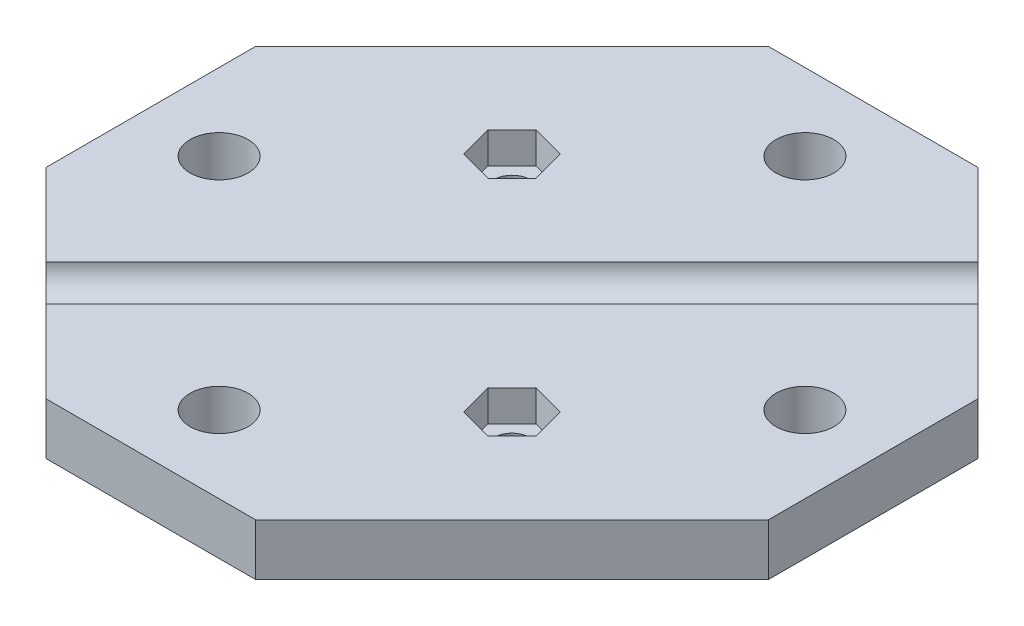
from build123d import *

# Parameters (mm, degrees)
SKETCH1_R           = 2.8
BOSS_EXTRUDE1_DEPTH = 5
CUT_EXTRUDE1_REACH  = 80.329
CUT_EXTRUDE2_DEPTH  = 3
CUT_EXTRUDE3_REACH  = 59.217
SKETCH6_R           = 1.75


with BuildPart() as part:
    # Sketch1 → Boss-Extrude1 (new body)
    with BuildSketch(Plane(origin=(0, 0, 0), x_dir=(1, 0, 0), z_dir=(0, 1, 0))):
        Polygon((-40.303943114, 15.555205773), (-15.555205773, 40.303943114), (4.694794227, 40.303943114), (24.042773974, 20.955963368), (24.042773974, 0.705963368), (-0.705963368, -24.042773974), (-20.955963368, -24.042773974), (-40.303943114, -4.694794227), align=None)
        with Locations(Location((-11.666118476, -16.618152771, 0), (0, 0, 270))):
            Circle(SKETCH1_R, mode=Mode.SUBTRACT)
        with Locations(Location((16.618152771, 11.666118476, 0), (0, 0, 270))):
            Circle(SKETCH1_R, mode=Mode.SUBTRACT)
        with Locations(Location((-4.595050664, 32.879321912, 0), (0, 0, 270))):
            Circle(SKETCH1_R, mode=Mode.SUBTRACT)
        with Locations(Location((-32.879321912, 4.595050664, 0), (0, 0, 270))):
            Circle(SKETCH1_R, mode=Mode.SUBTRACT)
    extrude(amount=BOSS_EXTRUDE1_DEPTH)

    # Sketch4 → Cut-Extrude1 (cut, up to next)
    with BuildSketch(Plane(origin=(22.499368671, 0, -22.499368671), x_dir=(-0.7071067811865465, 0, -0.7071067811865487), z_dir=(0.7071067811865487, 0, -0.7071067811865465)), mode=Mode.PRIVATE) as cut_extrude1_sk1:
        with BuildLine():
            Line((13.998382969, 5), (8.998382969, 5))
            ThreePointArc((8.998382969, 5), (11.498382969, 2.5), (13.998382969, 5))
        make_face()
    cut_extrude1_tool1 = extrude(cut_extrude1_sk1.sketch, amount=-CUT_EXTRUDE1_REACH, mode=Mode.PRIVATE) & part.part
    add(cut_extrude1_tool1.solids().sort_by_distance((14.368784, 3.938967, -30.629953))[0], mode=Mode.SUBTRACT)

    # Sketch5 → Cut-Extrude2 (cut)
    with BuildSketch(Plane(origin=(0, 5, 0), x_dir=(1, 0, 0), z_dir=(0, 1, 0))):
        Polygon((-16.586947728, 21.240978239), (-19.765709682, 22.092724938), (-22.092724938, 19.765709682), (-21.240978239, 16.586947728), (-18.062216285, 15.735201029), (-15.735201029, 18.062216285), align=None)
        Polygon((4.979809098, -0.325778587), (1.801047144, 0.525968112), (-0.525968112, -1.801047144), (0.325778587, -4.979809098), (3.504540541, -5.831555797), (5.831555797, -3.504540541), align=None)
    extrude(amount=-CUT_EXTRUDE2_DEPTH, mode=Mode.SUBTRACT)

    # Sketch6 → Cut-Extrude3 (cut, up to next)
    with BuildSketch(Plane(origin=(0, 5, 0), x_dir=(1, 0, 0), z_dir=(0, 1, 0)), mode=Mode.PRIVATE) as cut_extrude3_sk1:
        with Locations(Location((-18.913962984, 18.913962984, 0), (0, 0, 270))):
            Circle(SKETCH6_R)
    cut_extrude3_tool1 = extrude(cut_extrude3_sk1.sketch, amount=-CUT_EXTRUDE3_REACH, mode=Mode.PRIVATE) & part.part
    # Sketch6 → Cut-Extrude3 (cut, up to next)
    with BuildSketch(Plane(origin=(0, 5, 0), x_dir=(1, 0, 0), z_dir=(0, 1, 0)), mode=Mode.PRIVATE) as cut_extrude3_sk2:
        with Locations(Location((2.652793843, -2.652793843, 0), (0, 0, 270))):
            Circle(SKETCH6_R)
    cut_extrude3_tool2 = extrude(cut_extrude3_sk2.sketch, amount=-CUT_EXTRUDE3_REACH, mode=Mode.PRIVATE) & part.part
    add(cut_extrude3_tool1.solids().sort_by_distance((-18.913963, 5, -18.913963))[0], mode=Mode.SUBTRACT)
    add(cut_extrude3_tool2.solids().sort_by_distance((2.652794, 5, 2.652794))[0], mode=Mode.SUBTRACT)


solid = part.part
